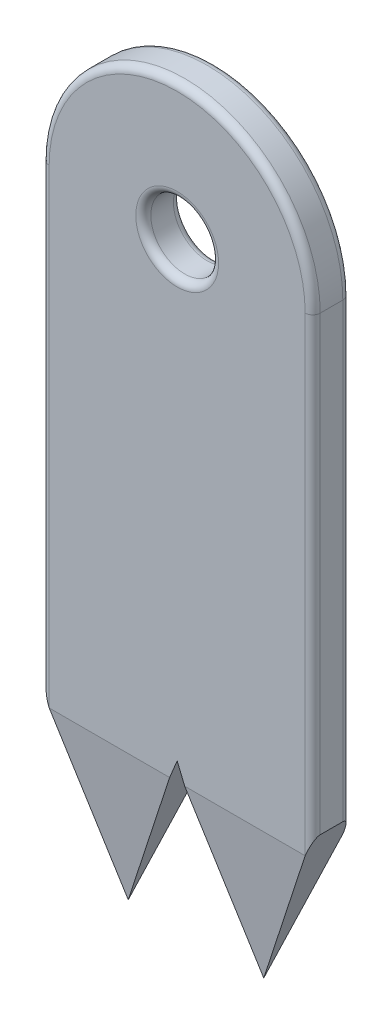
from build123d import *

# Parameters (mm, degrees)
SKETCH1_R               = 4.5
BOSS_EXTRUDE1_DEPTH     = 5
FILLET1_R               = 1
CUT_EXTRUDE1_DEPTH      = 78.139851996
CUT_EXTRUDE1_DEPTH_BACK = 78.139851996
CUT_EXTRUDE3_DEPTH      = 80.375373419
CUT_EXTRUDE3_DEPTH_BACK = 80.375373419


with BuildPart() as part:
    # Sketch1 → Boss-Extrude1 (new body)
    with BuildSketch(Plane.XY):
        with BuildLine():
            Line((-21.758850115, -29.16270467), (-30.758850115, -7.434782609))
            Line((-30.758850115, -7.434782609), (-30.758850115, 52.565217391))
            ThreePointArc((-30.758850115, 52.565217391), (-12.758850115, 70.565217391), (5.241149885, 52.565217391))
            Line((5.241149885, 52.565217391), (5.241149885, -7.434782609))
            Line((5.241149885, -7.434782609), (-3.758850115, -29.16270467))
            Line((-3.758850115, -29.16270467), (-12.758850115, -7.434782609))
            Line((-12.758850115, -7.434782609), (-21.758850115, -29.16270467))
        make_face()
        with Locations((-12.758850115, 52.565217391)):
            Circle(SKETCH1_R, mode=Mode.SUBTRACT)
    extrude(amount=BOSS_EXTRUDE1_DEPTH)

    # Fillet1
    fillet1_edges = [part.edges().sort_by_distance(p)[0] for p in [
        (5.241149885, 22.565217391, 5),
        (-17.258850115, 52.565217391, 0),
        (-17.258850115, 52.565217391, 5),
        (-12.758850115, 70.565217391, 5),
        (-30.758850115, 22.565217391, 5),
        (-30.758850115, 22.565217391, 0),
        (-12.758850115, 70.565217391, 0),
        (5.241149885, 22.565217391, 0),
    ]]
    fillet(fillet1_edges, radius=FILLET1_R)

    # Sketch5 → Cut-Extrude1 (cut, two sides: drawn at the far end of the back side and taken through both)
    with BuildSketch(Plane(origin=(0, 0, 0), x_dir=(0, 0, -1), z_dir=(1, 0, 0)).offset(-CUT_EXTRUDE1_DEPTH_BACK)):
        Polygon((-2.5, -29.16270467), (-5, -9.848996171), (-5, -29.16270467), align=None)
    extrude(amount=CUT_EXTRUDE1_DEPTH + CUT_EXTRUDE1_DEPTH_BACK, mode=Mode.SUBTRACT)

    # Sketch9 → Cut-Extrude3 (cut, two sides: drawn at the far end of the back side and taken through both)
    with BuildSketch(Plane(origin=(5.241149885, 0, 0), x_dir=(0, 0, -1), z_dir=(1, 0, 0)).offset(-CUT_EXTRUDE3_DEPTH_BACK)):
        Polygon((-2.5, -29.16270467), (0, -9.848996171), (0, -29.16270467), align=None)
    extrude(amount=CUT_EXTRUDE3_DEPTH + CUT_EXTRUDE3_DEPTH_BACK, mode=Mode.SUBTRACT)


solid = part.part
